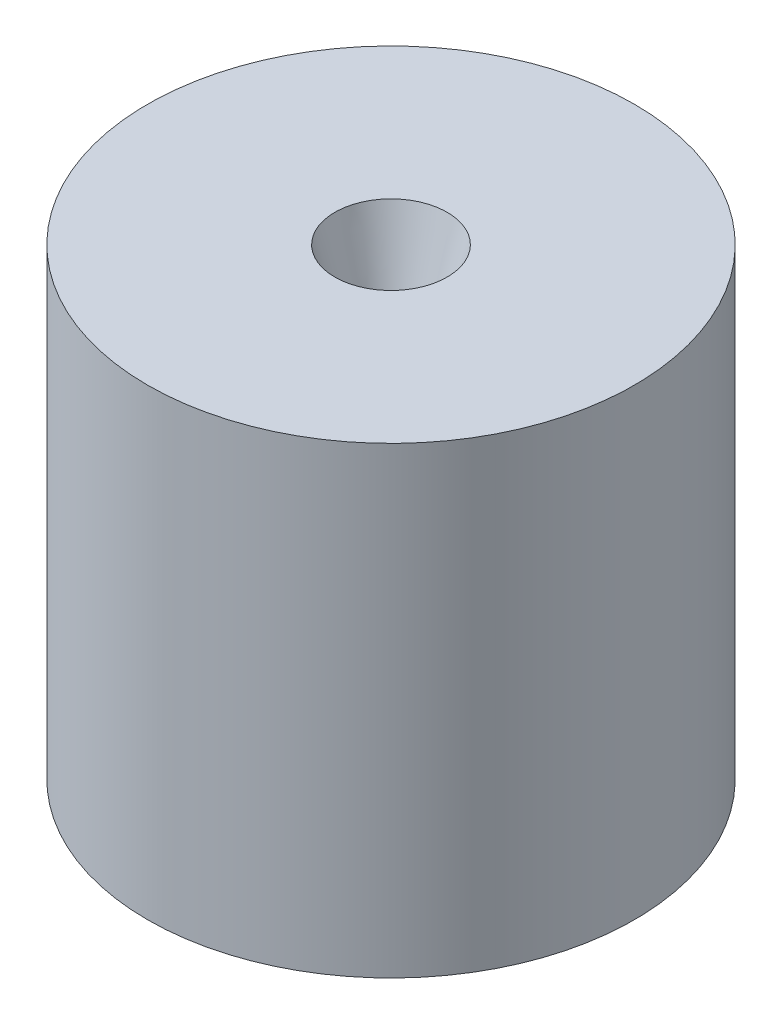
from build123d import *


with BuildPart() as part:
    # Sketch1 → Revolve1 (revolve)
    with BuildSketch(Plane.XY, mode=Mode.PRIVATE) as revolve1_sk:
        Polygon((-1, 2.5), (-1, -2.5), (-6.5, -8), (-6.5, 4.366025404), (-1.5, 4.366025404), align=None)
    revolve(revolve1_sk.sketch.rotate(Axis((0, 20.798274686, 0), (0, -1, 0)), 270), axis=Axis((0, 20.798274686, 0), (0, -1, 0)))


solid = part.part
